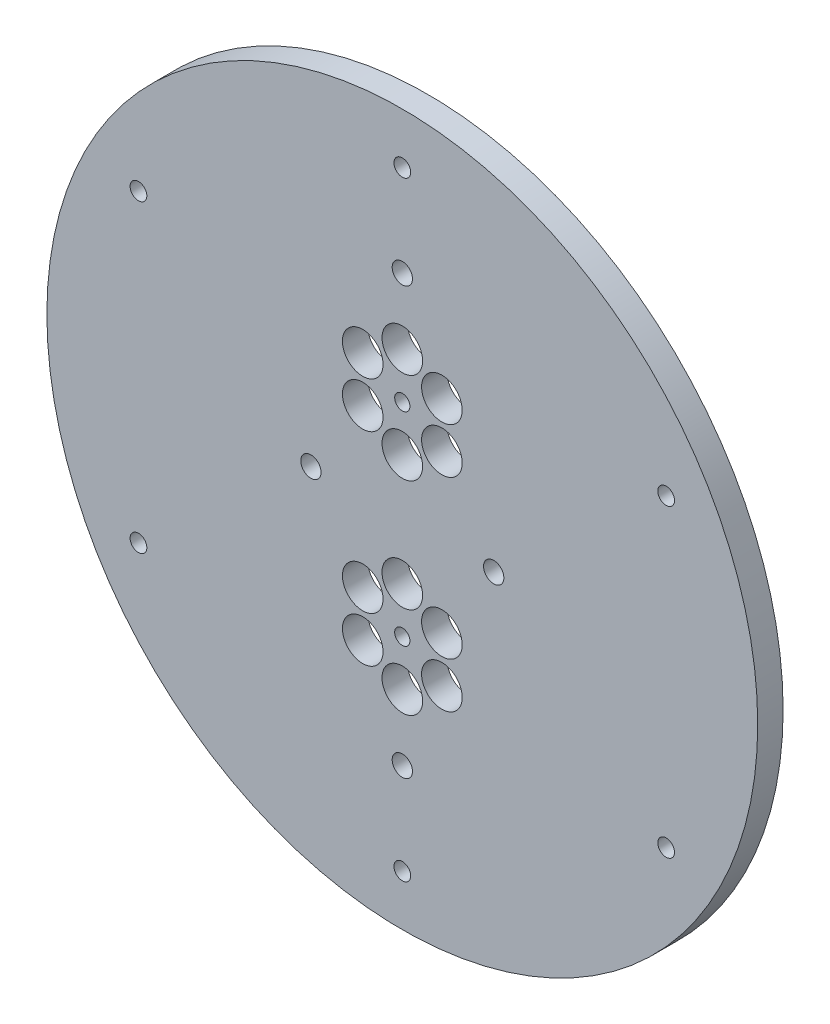
from build123d import *

# Parameters (mm, degrees)
SKETCH1_R           = 70
SKETCH1_R_2         = 1.65
SKETCH1_R_3         = 4
SKETCH1_R_4         = 1.5
BOSS_EXTRUDE1_DEPTH = 5
SKETCH2_R           = 2
CUT_EXTRUDE1_DEPTH  = 100.121138008


with BuildPart() as part:
    # Sketch1 → Boss-Extrude1 (new body)
    with BuildSketch(Plane.XY):
        Circle(SKETCH1_R)
        with Locations((0, 60)):
            Circle(SKETCH1_R_2, mode=Mode.SUBTRACT)
        with Locations((51.961524227, 30)):
            Circle(SKETCH1_R_2, mode=Mode.SUBTRACT)
        with Locations((51.961524227, -30)):
            Circle(SKETCH1_R_2, mode=Mode.SUBTRACT)
        with Locations((0, -60)):
            Circle(SKETCH1_R_2, mode=Mode.SUBTRACT)
        with Locations((-51.961524227, -30)):
            Circle(SKETCH1_R_2, mode=Mode.SUBTRACT)
        with Locations((-51.961524227, 30)):
            Circle(SKETCH1_R_2, mode=Mode.SUBTRACT)
        with Locations((0, 29)):
            Circle(SKETCH1_R_3, mode=Mode.SUBTRACT)
        with Locations((7.794228634, 24.5)):
            Circle(SKETCH1_R_3, mode=Mode.SUBTRACT)
        with Locations((7.794228634, 15.5)):
            Circle(SKETCH1_R_3, mode=Mode.SUBTRACT)
        with Locations((0, 11)):
            Circle(SKETCH1_R_3, mode=Mode.SUBTRACT)
        with Locations((-7.794228634, 15.5)):
            Circle(SKETCH1_R_3, mode=Mode.SUBTRACT)
        with Locations((-7.794228634, 24.5)):
            Circle(SKETCH1_R_3, mode=Mode.SUBTRACT)
        with Locations((0, 20)):
            Circle(SKETCH1_R_4, mode=Mode.SUBTRACT)
        with Locations(Location((7.794228634, -15.5, 0), (0, 0, 180))):
            Circle(SKETCH1_R_3, mode=Mode.SUBTRACT)
        with Locations(Location((0, -11, 0), (0, 0, 180))):
            Circle(SKETCH1_R_3, mode=Mode.SUBTRACT)
        with Locations(Location((-7.794228634, -15.5, 0), (0, 0, 180))):
            Circle(SKETCH1_R_3, mode=Mode.SUBTRACT)
        with Locations(Location((0, -20, 0), (0, 0, 180))):
            Circle(SKETCH1_R_4, mode=Mode.SUBTRACT)
        with Locations(Location((-7.794228634, -24.5, 0), (0, 0, 180))):
            Circle(SKETCH1_R_3, mode=Mode.SUBTRACT)
        with Locations(Location((0, -29, 0), (0, 0, 180))):
            Circle(SKETCH1_R_3, mode=Mode.SUBTRACT)
        with Locations(Location((7.794228634, -24.5, 0), (0, 0, 180))):
            Circle(SKETCH1_R_3, mode=Mode.SUBTRACT)
    extrude(amount=BOSS_EXTRUDE1_DEPTH)

    # Sketch2 → Cut-Extrude1 (cut, through all)
    with BuildSketch(Plane.XY.offset(5)):
        with Locations((0, 42)):
            Circle(SKETCH2_R)
        with Locations((0, -42)):
            Circle(SKETCH2_R)
        with Locations((18, 0)):
            Circle(SKETCH2_R)
        with Locations((-18, 0)):
            Circle(SKETCH2_R)
    extrude(amount=-CUT_EXTRUDE1_DEPTH, mode=Mode.SUBTRACT)


solid = part.part
